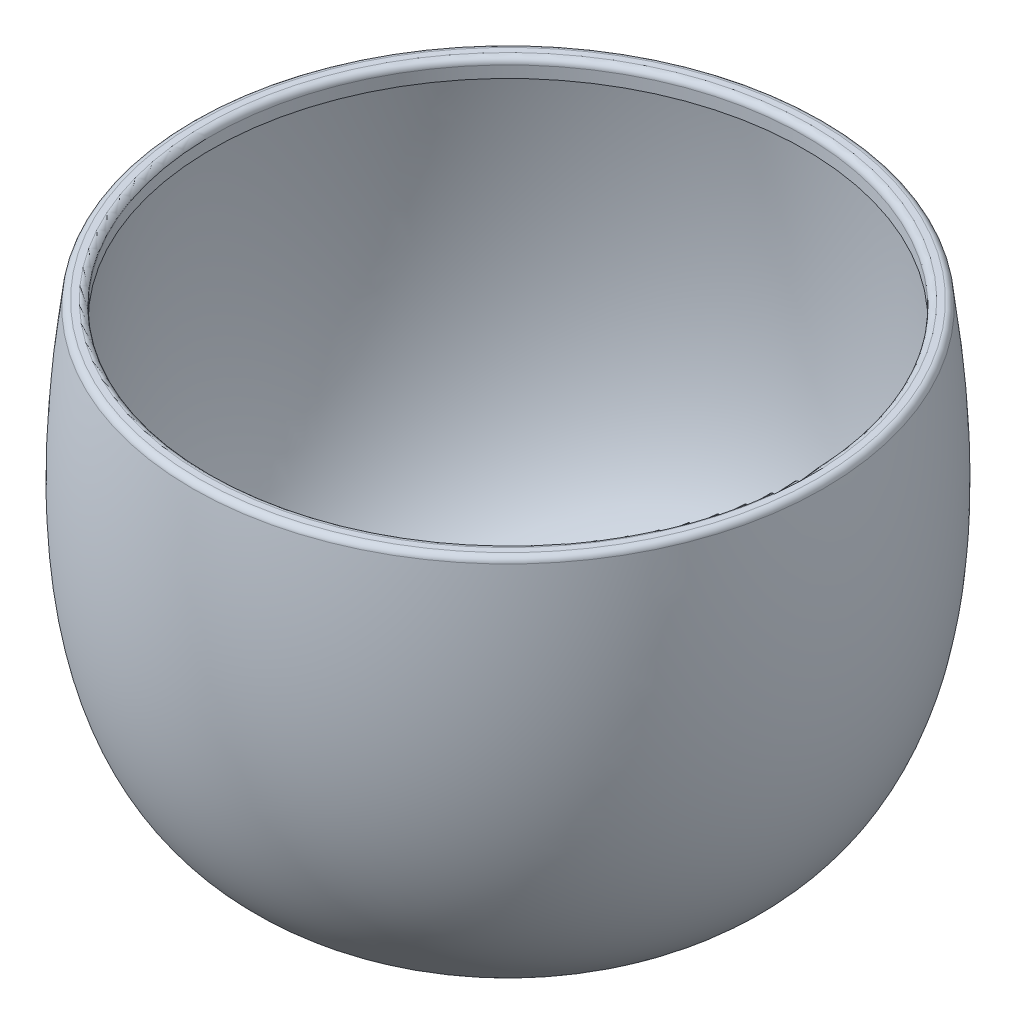
from build123d import *

# Parameters (mm, degrees)
SHELL2_T           = 2.54
SKETCH4_R          = 41.91
CUT_EXTRUDE3_DEPTH = 2.54
FILLET9_R          = 0.889
FILLET10_R         = 0.254


with BuildPart() as part:
    # Sketch2 → Revolve1 (revolve)
    with BuildSketch(Plane(origin=(0, 0, 0), x_dir=(0, 0, -1), z_dir=(1, 0, 0))):
        with BuildLine():
            Line((-9.028340483, -5.031337592), (16.371659517, -5.031337592))
            add(Edge.make_bspline(
                [(35.421659517, 58.468662408), (42.976011701, 3.763489576), (16.371659517, -5.031337592)],
                knots=[0, 0, 0, 0.72299757, 0.72299757, 0.72299757], degree=2))
            Line((35.421659517, 58.468662408), (-9.028340483, 58.468662408))
            Line((-9.028340483, 58.468662408), (-9.028340483, -5.031337592))
        make_face()
    revolve(axis=Axis((0, -5.031337592, 9.028340483), (0, 1, 0)))

    # Shell2 (no face opened: a closed hollow body)
    add(offset(amount=-SHELL2_T, mode=Mode.PRIVATE), mode=Mode.SUBTRACT)

    # Sketch4 → Cut-Extrude3 (cut)
    with BuildSketch(Plane(origin=(0, 58.468662408, 0), x_dir=(1, 0, 0), z_dir=(0, 1, 0))):
        with Locations(Location((0, -9.028340483, 0), (0, 0, 270))):
            Circle(SKETCH4_R)
    extrude(amount=-CUT_EXTRUDE3_DEPTH, mode=Mode.SUBTRACT)

    # Fillet9
    fillet9_edges = [part.edges().sort_by_distance(p)[0] for p in [
        (0, 58.468662408, -32.881659517),
        (0, 58.468662408, 53.478340483),
    ]]
    fillet(fillet9_edges, radius=FILLET9_R)

    # Fillet10
    fillet10_edges = [part.edges().sort_by_distance(p)[0] for p in [
        (0, 55.928662408, 51.253490208),
    ]]
    fillet(fillet10_edges, radius=FILLET10_R)


solid = part.part
